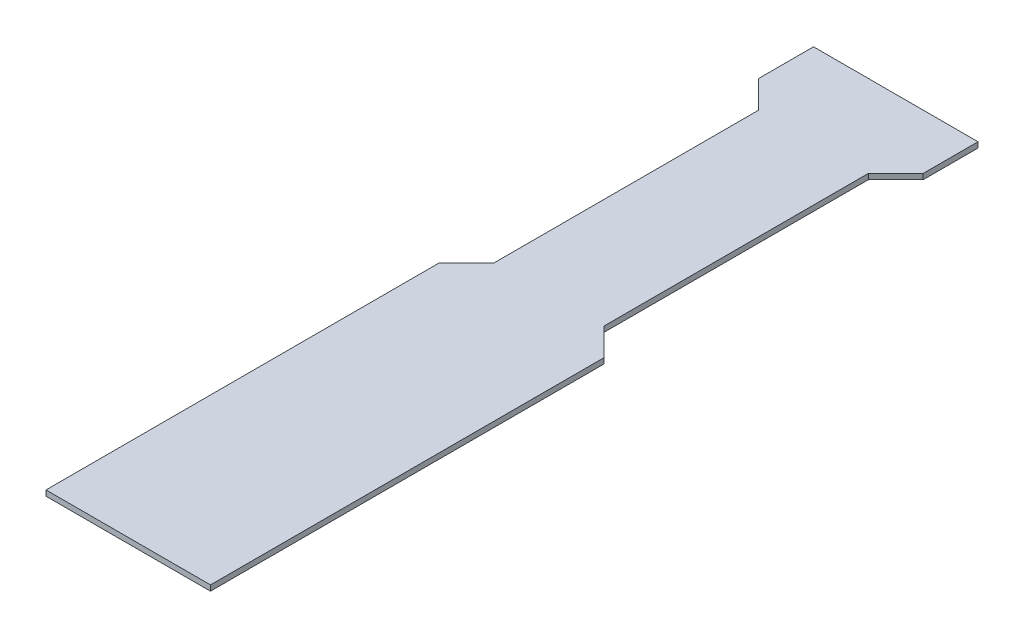
from build123d import *

# Parameters (mm, degrees)
EXTRUDE_1_DEPTH = 2


with BuildPart() as part:
    # 草图1 → 凸台-拉伸1 (new body)
    with BuildSketch(Plane(origin=(0, 0, 0), x_dir=(1, 0, 0), z_dir=(0, 1, 0))):
        Polygon((30, 260), (30, 280), (-30, 280), (-30, 260), (-20, 250), (-20, 240), (-20, 153.5), (-30, 143.5), (-30, 0), (0, 0), (30, 0), (30, 143.5), (20, 153.5), (20, 240), (20, 250), align=None)
    extrude(amount=EXTRUDE_1_DEPTH)


solid = part.part
